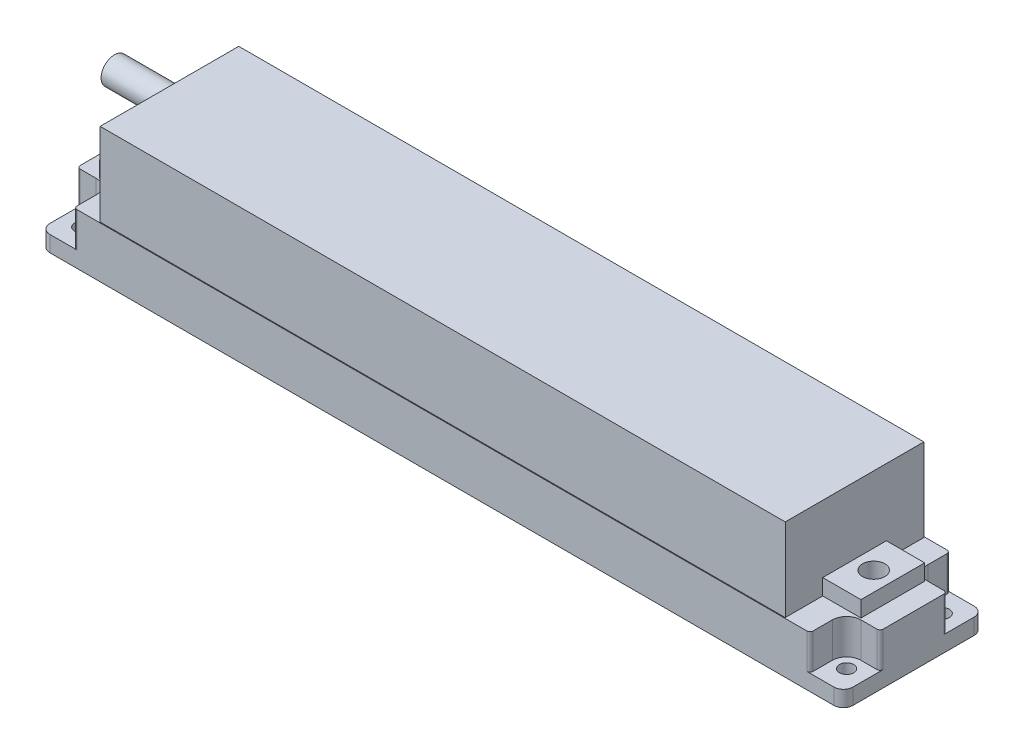
from build123d import *

# Parameters (mm, degrees)
SKETCH_1_W          = 215
SKETCH_1_H          = 43.5
EXTRUDE_1_DEPTH     = 26
SKETCH_2_W          = 12
SKETCH_2_H          = 20
SKETCH_2_R          = 3.5
EXTRUDE_2_DEPTH     = 5
SKETCH_3_R          = 4.2
EXTRUDE_3_DEPTH     = 25
SKETCH_4_W          = 252
SKETCH_4_H          = 44
SKETCH_4_R          = 2.25
SKETCH_4_R_2        = 2.6
SKETCH_4_W_2        = 200
SKETCH_4_H_2        = 34
EXTRUDE_4_DEPTH     = 16
SKETCH_5_R          = 2.25
CUT_EXTRUDE_1_DEPTH = 11
FILLET_1_R          = 3
FILLET_2_R          = 10
FILLET_3_R          = 1


with BuildPart() as part:
    # ｽｹｯﾁ1 → ﾎﾞｽ - 押し出し1 (new body)
    with BuildSketch(Plane(origin=(0, 0, 0), x_dir=(1, 0, 0), z_dir=(0, 1, 0))):
        Rectangle(SKETCH_1_W, SKETCH_1_H)
    extrude(amount=EXTRUDE_1_DEPTH)

    # ｽｹｯﾁ2 → ﾎﾞｽ - 押し出し2 (add)
    # profile 1 of 2: a face of its own
    with BuildSketch(Plane.XZ):
        with Locations((-113.5, 0)):
            Rectangle(SKETCH_2_W, SKETCH_2_H)
        with Locations(Location((-113.5, 0, 0), (0, 0, 270))):
            Circle(SKETCH_2_R, mode=Mode.SUBTRACT)
    # profile 2 of 2: a face of its own
    with BuildSketch(Plane.XZ):
        with Locations((113.5, 0)):
            Rectangle(SKETCH_2_W, SKETCH_2_H)
        with Locations(Location((113.5, 0, 0), (0, 0, 90))):
            Circle(SKETCH_2_R, mode=Mode.SUBTRACT)
    extrude(amount=-EXTRUDE_2_DEPTH)

    # ｽｹｯﾁ3 → ﾎﾞｽ - 押し出し3 (add)
    with BuildSketch(Plane.ZY.offset(107.5)):
        with Locations(Location((-7.75, 14, 0), (0, 0, 180))):
            Circle(SKETCH_3_R)
    extrude(amount=EXTRUDE_3_DEPTH)


with BuildPart() as body_2:
    # ｽｹｯﾁ4 → ﾎﾞｽ - 押し出し4 (new body)
    with BuildSketch(Plane.XZ):
        Rectangle(SKETCH_4_W, SKETCH_4_H)
        with Locations(Location((-120, -15, 0), (0, 0, 270))):
            Circle(SKETCH_4_R, mode=Mode.SUBTRACT)
        with Locations(Location((-120, 15, 0), (0, 0, 270))):
            Circle(SKETCH_4_R, mode=Mode.SUBTRACT)
        with Locations(Location((120, 15, 0), (0, 0, 270))):
            Circle(SKETCH_4_R, mode=Mode.SUBTRACT)
        with Locations(Location((120, -15, 0), (0, 0, 270))):
            Circle(SKETCH_4_R, mode=Mode.SUBTRACT)
        with Locations(Location((-113.5, 0, 0), (0, 0, 270))):
            Circle(SKETCH_4_R_2, mode=Mode.SUBTRACT)
        with Locations(Location((113.5, 0, 0), (0, 0, 270))):
            Circle(SKETCH_4_R_2, mode=Mode.SUBTRACT)
        Rectangle(SKETCH_4_W_2, SKETCH_4_H_2, mode=Mode.SUBTRACT)
    extrude(amount=EXTRUDE_4_DEPTH)

    # ｽｹｯﾁ5 → ｶｯﾄ - 押し出し1 (cut)
    # profile 1 of 4: a face of its own
    with BuildSketch(Plane(origin=(0, 0, 0), x_dir=(1, 0, 0), z_dir=(0, 1, 0))):
        with BuildLine():
            Line((-126, -10.5), (-126, -22))
            Line((-126, -22), (-115.5, -22))
            Line((-115.5, -22), (-115.5, -15))
            ThreePointArc((-115.5, -15), (-116.818019485, -11.818019485), (-120, -10.5))
            Line((-120, -10.5), (-126, -10.5))
        make_face()
        with Locations(Location((-120, -15, 0), (0, 0, 270))):
            Circle(SKETCH_5_R, mode=Mode.SUBTRACT)
    # profile 2 of 4: a face of its own
    with BuildSketch(Plane(origin=(0, 0, 0), x_dir=(1, 0, 0), z_dir=(0, 1, 0))):
        with BuildLine():
            Line((115.5, -15), (115.5, -22))
            Line((115.5, -22), (126, -22))
            Line((126, -22), (126, -10.5))
            Line((126, -10.5), (120, -10.5))
            ThreePointArc((120, -10.5), (116.818019485, -11.818019485), (115.5, -15))
        make_face()
        with Locations(Location((120, -15, 0), (0, 0, 270))):
            Circle(SKETCH_5_R, mode=Mode.SUBTRACT)
    # profile 3 of 4: a face of its own
    with BuildSketch(Plane(origin=(0, 0, 0), x_dir=(1, 0, 0), z_dir=(0, 1, 0))):
        with BuildLine():
            Line((-126, 22), (-126, 10.5))
            Line((-126, 10.5), (-120, 10.5))
            ThreePointArc((-120, 10.5), (-116.818019485, 11.818019485), (-115.5, 15))
            Line((-115.5, 15), (-115.5, 22))
            Line((-115.5, 22), (-126, 22))
        make_face()
        with Locations(Location((-120, 15, 0), (0, 0, 270))):
            Circle(SKETCH_5_R, mode=Mode.SUBTRACT)
    # profile 4 of 4: a face of its own
    with BuildSketch(Plane(origin=(0, 0, 0), x_dir=(1, 0, 0), z_dir=(0, 1, 0))):
        with BuildLine():
            Line((120, 10.5), (126, 10.5))
            Line((126, 10.5), (126, 22))
            Line((126, 22), (115.5, 22))
            Line((115.5, 22), (115.5, 15))
            ThreePointArc((115.5, 15), (116.818019485, 11.818019485), (120, 10.5))
        make_face()
        with Locations(Location((120, 15, 0), (0, 0, 270))):
            Circle(SKETCH_5_R, mode=Mode.SUBTRACT)
    extrude(amount=-CUT_EXTRUDE_1_DEPTH, mode=Mode.SUBTRACT)

    # ﾌｨﾚｯﾄ1
    fillet_1_edges = [body_2.edges().sort_by_distance(p)[0] for p in [
        (-126, -13.5, 22),
        (126, -13.5, 22),
        (126, -13.5, -22),
        (-126, -13.5, -22),
    ]]
    fillet(fillet_1_edges, radius=FILLET_1_R)

    # ﾌｨﾚｯﾄ2
    fillet_2_edges = [body_2.edges().sort_by_distance(p)[0] for p in [
        (-100, -8, 17),
        (-100, -8, -17),
        (100, -8, -17),
        (100, -8, 17),
    ]]
    fillet(fillet_2_edges, radius=FILLET_2_R)

    # ﾌｨﾚｯﾄ3
    fillet_3_edges = [body_2.edges().sort_by_distance(p)[0] for p in [
        (126, -5.5, 10.5),
        (115.5, -5.5, 22),
        (-126, -5.5, -10.5),
        (-115.5, -5.5, -22),
        (-115.5, -5.5, 22),
        (-126, -5.5, 10.5),
        (126, -5.5, -10.5),
        (115.5, -5.5, -22),
    ]]
    fillet(fillet_3_edges, radius=FILLET_3_R)


solid = Compound([part.part, body_2.part])
